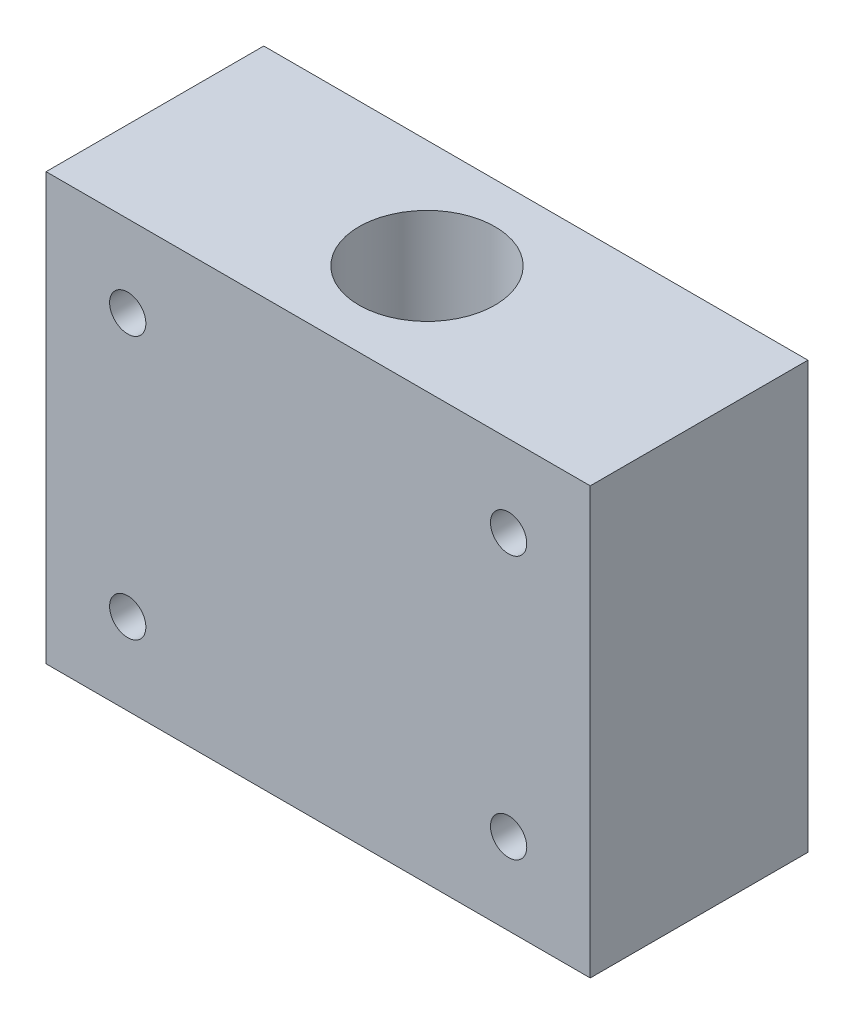
from build123d import *

# Parameters (mm, degrees)
SKETCH2_W           = 60
SKETCH2_H           = 24
SKETCH2_R           = 7.5
BOSS_EXTRUDE1_DEPTH = 47
SKETCH2_2_W         = 60
SKETCH2_2_H         = 24
SKETCH2_2_R         = 7.5
BOSS_EXTRUDE2_DEPTH = 25.5
SKETCH8_R           = 2
CUT_EXTRUDE1_DEPTH  = 61.704200843


with BuildPart() as part:
    # Sketch2 → Boss-Extrude1 (new body)
    with BuildSketch(Plane(origin=(0, 0, 0), x_dir=(1, 0, 0), z_dir=(0, 1, 0))):
        Rectangle(SKETCH2_W, SKETCH2_H)
        Circle(SKETCH2_R, mode=Mode.SUBTRACT)
    extrude(amount=BOSS_EXTRUDE1_DEPTH)

    # Sketch2<2> → Boss-Extrude2 (add)
    with BuildSketch(Plane(origin=(0, 0, 0), x_dir=(1, 0, 0), z_dir=(0, 1, 0))):
        Rectangle(SKETCH2_2_W, SKETCH2_2_H)
        Circle(SKETCH2_2_R, mode=Mode.SUBTRACT)
    extrude(amount=BOSS_EXTRUDE2_DEPTH)

    # Sketch8 → Cut-Extrude1 (cut, through all)
    with BuildSketch(Plane.XY.offset(12)):
        with Locations((-21, 9)):
            Circle(SKETCH8_R)
        with Locations((-21, 38)):
            Circle(SKETCH8_R)
        with Locations((21, 38)):
            Circle(SKETCH8_R)
        with Locations((21, 9)):
            Circle(SKETCH8_R)
    extrude(amount=-CUT_EXTRUDE1_DEPTH, mode=Mode.SUBTRACT)


solid = part.part
